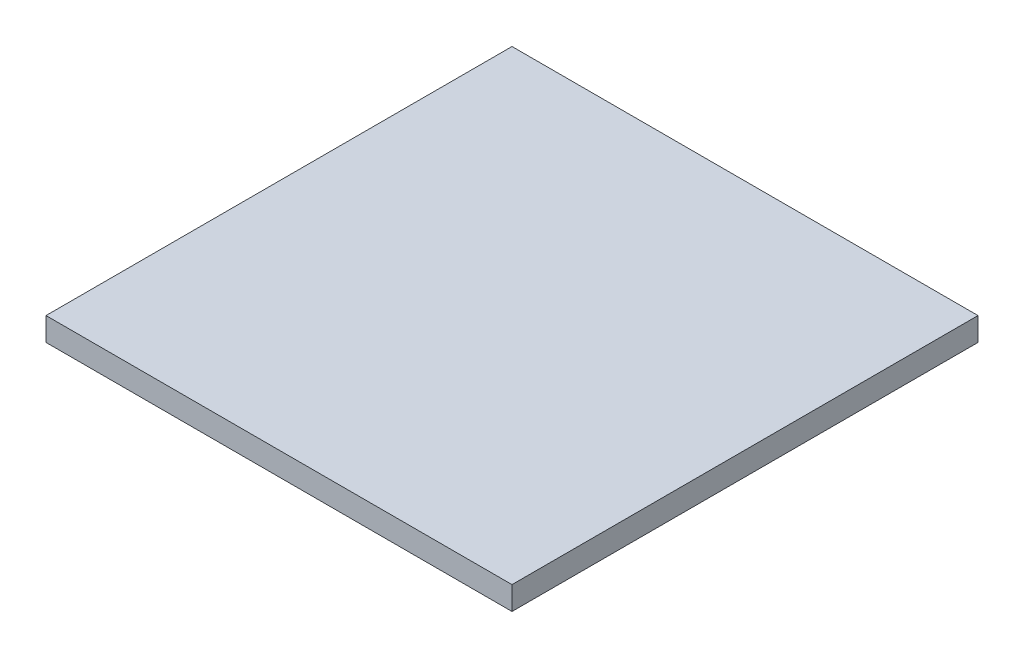
from build123d import *

# Parameters (mm, degrees)
CROQUIS1_W              = 20
CROQUIS1_H              = 20
SALIENTE_EXTRUIR1_DEPTH = 1


with BuildPart() as part:
    # Croquis1 → Saliente-Extruir1 (new body)
    with BuildSketch(Plane(origin=(0, 0, 0), x_dir=(1, 0, 0), z_dir=(0, 1, 0))):
        with Locations((10, 10)):
            Rectangle(CROQUIS1_W, CROQUIS1_H)
    extrude(amount=SALIENTE_EXTRUIR1_DEPTH)


solid = part.part
